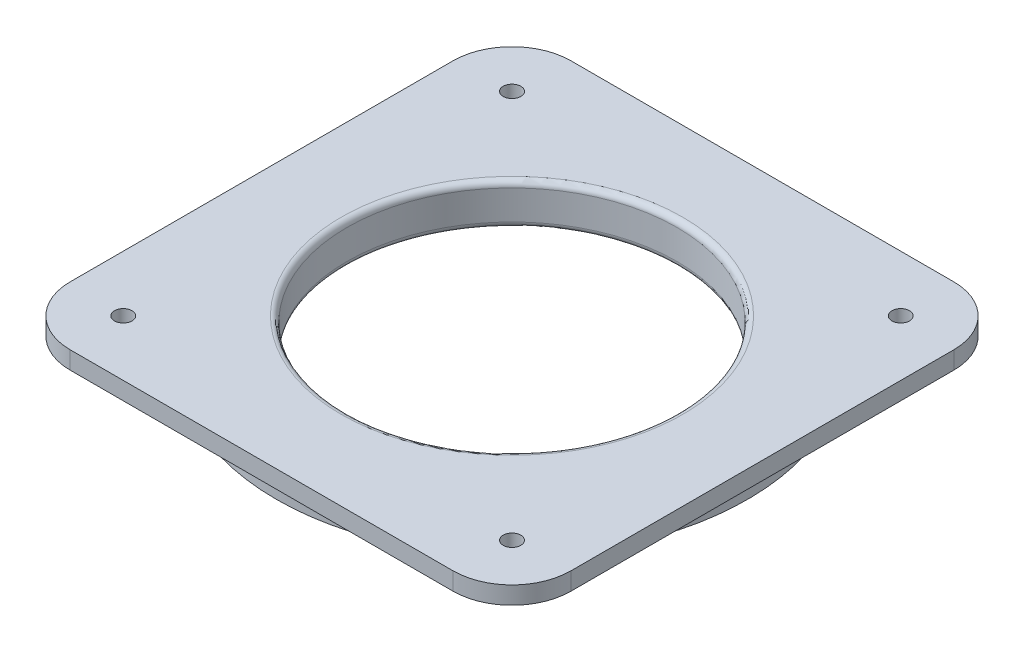
from build123d import *

# Parameters (mm, degrees)
ESBO_O1_W                = 85
ESBO_O1_H                = 85
RESSALTO_EXTRUS_O1_DEPTH = 3
ESBO_O2_W                = 40
ESBO_O2_H                = 4
FURO_COM_FOLGA_DE_M521_D = 56
FILETE1_R                = 1
FILETE2_R                = 10
ESBO_O5_R                = 1.5
CORTE_EXTRUS_O1_DEPTH    = 10
FILETE3_R                = 0.5


with BuildPart() as part:
    # Esboço1 → Ressalto-extrusão1 (new body)
    with BuildSketch(Plane.XZ.offset(3)):
        Rectangle(ESBO_O1_W, ESBO_O1_H)
    extrude(amount=-RESSALTO_EXTRUS_O1_DEPTH)

    # Esboço2 → Revolução1 (revolve)
    with BuildSketch(Plane(origin=(0, 0, 0), x_dir=(-1, 0, 0), z_dir=(0, 0, -1)), mode=Mode.PRIVATE) as revolu_o1_sk:
        with Locations((-20, -5)):
            Rectangle(ESBO_O2_W, ESBO_O2_H)
    revolve(revolu_o1_sk.sketch.rotate(Axis((0, -7, 0), (0, 1, 0)), 270), axis=Axis((0, -7, 0), (0, 1, 0)))

    # Furo com folga de M521 (through all)
    with Locations(Plane(origin=(0, 0, 0), x_dir=(1, 0, 0), z_dir=(0, 1, 0))):
        with Locations((0, 0)):
            Hole(FURO_COM_FOLGA_DE_M521_D / 2)

    # Filete1
    filete1_edges = [part.edges().sort_by_distance(p)[0] for p in [
        (28, 0, 0),
        (28, -7, 0),
    ]]
    fillet(filete1_edges, radius=FILETE1_R)

    # Filete2
    filete2_edges = [part.edges().sort_by_distance(p)[0] for p in [
        (42.5, -1.5, 42.5),
        (42.5, -1.5, -42.5),
        (-42.5, -1.5, -42.5),
        (-42.5, -1.5, 42.5),
    ]]
    fillet(filete2_edges, radius=FILETE2_R)

    # Esboço5 → Corte-extrusão1 (cut)
    with BuildSketch(Plane.XZ.offset(3)):
        with Locations(Location((33, 33, 0), (0, 0, 270))):
            Circle(ESBO_O5_R)
        with Locations(Location((33, -33, 0), (0, 0, 270))):
            Circle(ESBO_O5_R)
        with Locations(Location((-33, 33, 0), (0, 0, 270))):
            Circle(ESBO_O5_R)
        with Locations(Location((-33, -33, 0), (0, 0, 270))):
            Circle(ESBO_O5_R)
    extrude(amount=-CORTE_EXTRUS_O1_DEPTH, mode=Mode.SUBTRACT)

    # Filete3
    filete3_edges = [part.edges().sort_by_distance(p)[0] for p in [
        (33, -3, -31.5),
        (-33, -3, 34.5),
        (-33, -3, -31.5),
        (33, -3, 34.5),
    ]]
    fillet(filete3_edges, radius=FILETE3_R)


solid = part.part
